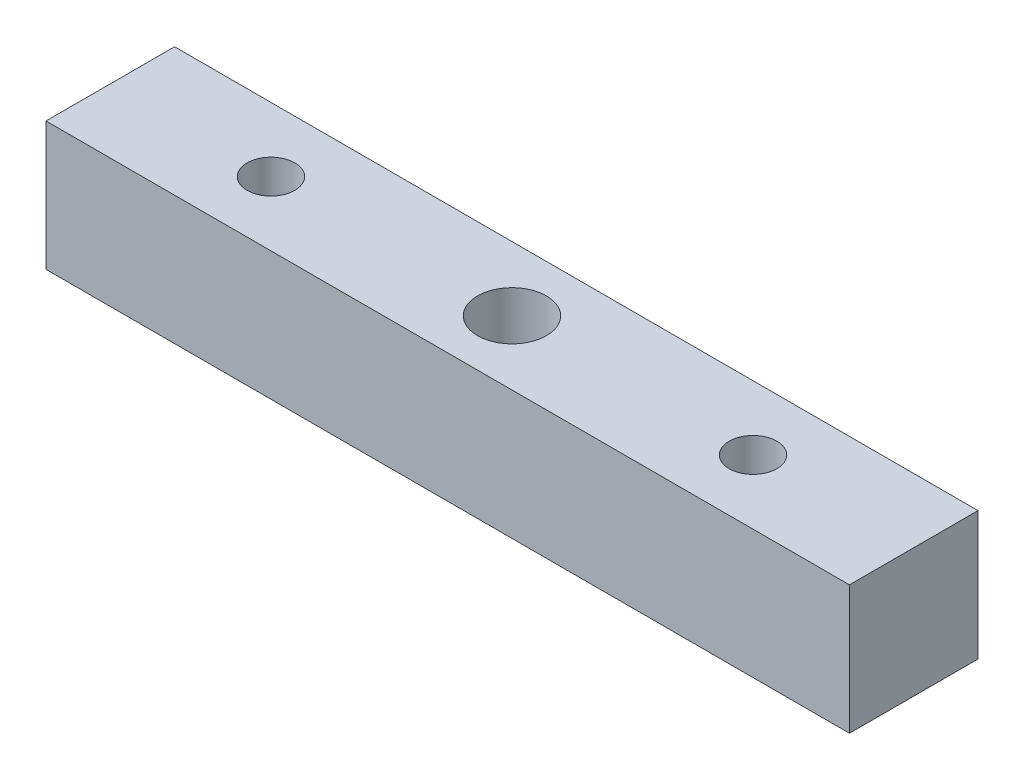
from build123d import *

# Parameters (mm, degrees)
SKETCH1_W           = 50
SKETCH1_H           = 8
BOSS_EXTRUDE1_DEPTH = 8
SKETCH2_R           = 2.145
SKETCH2_R_2         = 1.485
CUT_EXTRUDE1_DEPTH  = 8


with BuildPart() as part:
    # Sketch1 → Boss-Extrude1 (new body)
    with BuildSketch(Plane(origin=(0, 0, 0), x_dir=(1, 0, 0), z_dir=(0, 1, 0))):
        Rectangle(SKETCH1_W, SKETCH1_H)
    extrude(amount=BOSS_EXTRUDE1_DEPTH)

    # Sketch2 → Cut-Extrude1 (cut)
    with BuildSketch(Plane(origin=(0, 8, 0), x_dir=(1, 0, 0), z_dir=(0, 1, 0))):
        with Locations(Location((0, 0, 0), (0, 0, 270))):
            Circle(SKETCH2_R)
        with Locations(Location((-15, 0, 0), (0, 0, 270))):
            Circle(SKETCH2_R_2)
        with Locations(Location((15, 0, 0), (0, 0, 270))):
            Circle(SKETCH2_R_2)
    extrude(amount=-CUT_EXTRUDE1_DEPTH, mode=Mode.SUBTRACT)


solid = part.part
